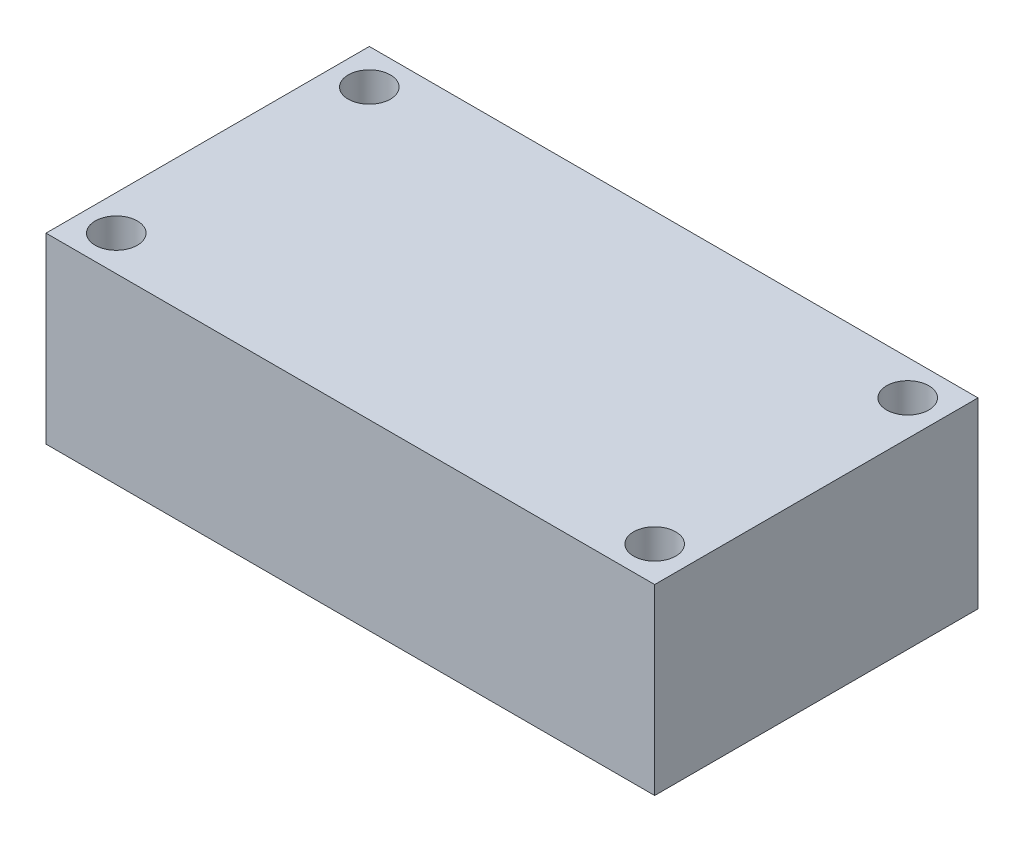
from build123d import *

# Parameters (mm, degrees)
SZKIC1_W                    = 43.3
SZKIC1_H                    = 23
SZKIC1_R                    = 1.5
DODANIE_WYCI_GNI_CIE1_DEPTH = 13


with BuildPart() as part:
    # Szkic1 → Dodanie-wyciągnięcie1 (new body)
    with BuildSketch(Plane(origin=(0, 0, 0), x_dir=(1, 0, 0), z_dir=(0, 1, 0))):
        with Locations((21.65, 11.5)):
            Rectangle(SZKIC1_W, SZKIC1_H)
        with Locations(Location((40.8, 2.5, 0), (0, 0, 90))):
            Circle(SZKIC1_R, mode=Mode.SUBTRACT)
        with Locations(Location((2.5, 2.5, 0), (0, 0, 90))):
            Circle(SZKIC1_R, mode=Mode.SUBTRACT)
        with Locations(Location((2.5, 20.5, 0), (0, 0, 90))):
            Circle(SZKIC1_R, mode=Mode.SUBTRACT)
        with Locations(Location((40.8, 20.5, 0), (0, 0, 90))):
            Circle(SZKIC1_R, mode=Mode.SUBTRACT)
    extrude(amount=DODANIE_WYCI_GNI_CIE1_DEPTH)


solid = part.part
